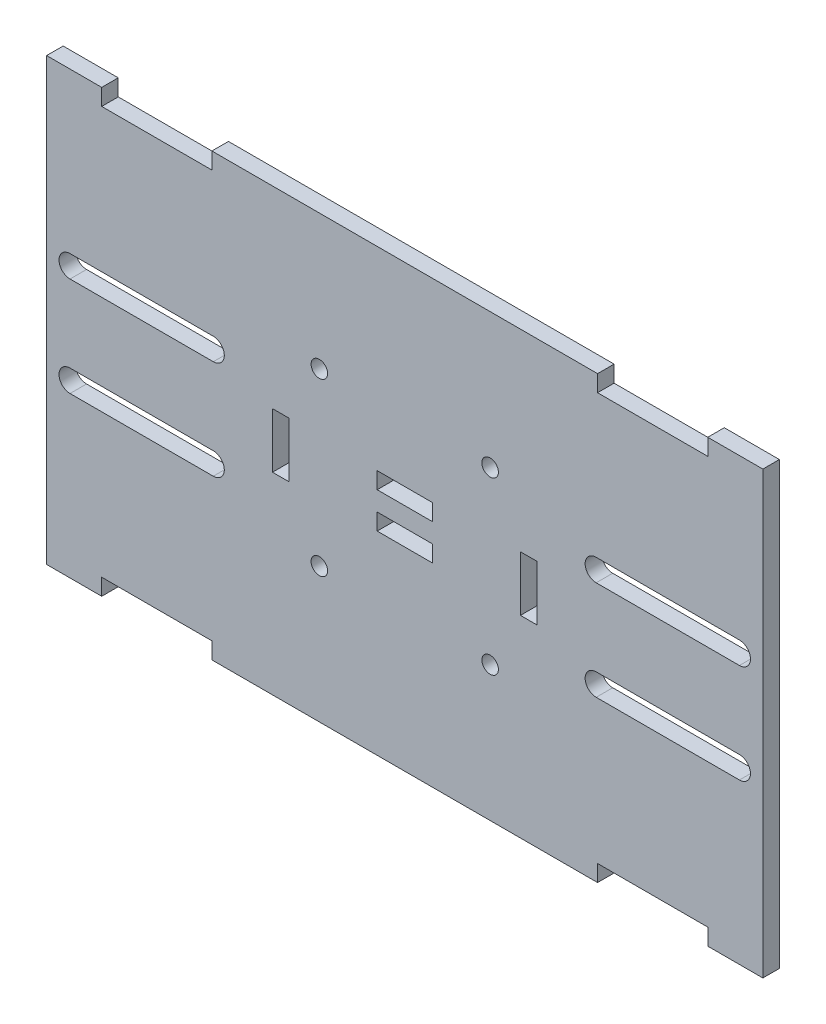
from build123d import *

# Parameters (mm, degrees)
SKETCH1_R           = 1.5
SKETCH1_W           = 3
SKETCH1_H           = 10
SKETCH1_W_2         = 10
SKETCH1_H_2         = 3
BOSS_EXTRUDE1_DEPTH = 3


with BuildPart() as part:
    # Sketch1 → Boss-Extrude1 (new body)
    with BuildSketch(Plane.XY):
        Polygon((-55, 40), (-55, 37), (-35, 37), (-35, 40), (35, 40), (35, 37), (55, 37), (55, 40), (65, 40), (65, -40), (55, -40), (55, -37), (35, -37), (35, -40), (-35, -40), (-35, -37), (-55, -37), (-55, -40), (-65, -40), (-65, 40), align=None)
        with Locations((15.5, 15.5)):
            Circle(SKETCH1_R, mode=Mode.SUBTRACT)
        with Locations((-15.5, 15.5)):
            Circle(SKETCH1_R, mode=Mode.SUBTRACT)
        with Locations((15.5, -15.5)):
            Circle(SKETCH1_R, mode=Mode.SUBTRACT)
        with Locations((-15.5, -15.5)):
            Circle(SKETCH1_R, mode=Mode.SUBTRACT)
        with Locations((22.5, 0)):
            Rectangle(SKETCH1_W, SKETCH1_H, mode=Mode.SUBTRACT)
        with Locations((-22.5, 0)):
            Rectangle(SKETCH1_W, SKETCH1_H, mode=Mode.SUBTRACT)
        with BuildLine():
            Line((-60.75, 11), (-34.75, 11))
            ThreePointArc((-34.75, 11), (-32.75, 9), (-34.75, 7))
            Line((-34.75, 7), (-60.75, 7))
            ThreePointArc((-60.75, 7), (-62.75, 9), (-60.75, 11))
        make_face(mode=Mode.SUBTRACT)
        with BuildLine():
            Line((-34.75, -7), (-60.75, -7))
            ThreePointArc((-60.75, -7), (-62.75, -9), (-60.75, -11))
            Line((-60.75, -11), (-34.75, -11))
            ThreePointArc((-34.75, -11), (-32.75, -9), (-34.75, -7))
        make_face(mode=Mode.SUBTRACT)
        with BuildLine():
            Line((34.75, 11), (60.75, 11))
            ThreePointArc((60.75, 11), (62.75, 9), (60.75, 7))
            Line((60.75, 7), (34.75, 7))
            ThreePointArc((34.75, 7), (32.75, 9), (34.75, 11))
        make_face(mode=Mode.SUBTRACT)
        with BuildLine():
            Line((34.75, -7), (60.75, -7))
            ThreePointArc((60.75, -7), (62.75, -9), (60.75, -11))
            Line((60.75, -11), (34.75, -11))
            ThreePointArc((34.75, -11), (32.75, -9), (34.75, -7))
        make_face(mode=Mode.SUBTRACT)
        with Locations((0, 3.25)):
            Rectangle(SKETCH1_W_2, SKETCH1_H_2, mode=Mode.SUBTRACT)
        with Locations((0, -3.25)):
            Rectangle(SKETCH1_W_2, SKETCH1_H_2, mode=Mode.SUBTRACT)
    extrude(amount=BOSS_EXTRUDE1_DEPTH)


solid = part.part
